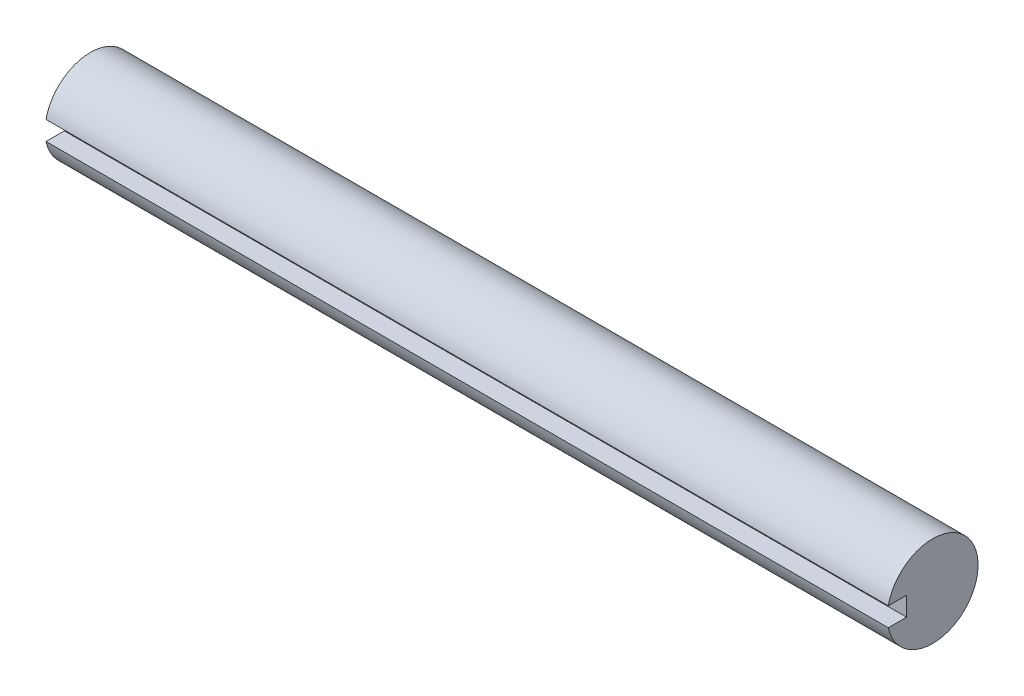
from build123d import *

# Parameters (mm, degrees)
BOSS_EXTRUDE2_DEPTH = 230


with BuildPart() as part:
    # Sketch1 → Boss-Extrude2 (new body)
    with BuildSketch(Plane.YZ):
        with BuildLine():
            Line((2.6, 7.124355653), (-2.6, 7.124355653))
            Line((-2.6, 7.124355653), (-2.6, 12.124355653))
            ThreePointArc((-2.6, 12.124355653), (-7.794870108, -9.643650761), (12.4, 0))
            ThreePointArc((12.4, 0), (9.643650761, 7.794870108), (2.6, 12.124355653))
            Line((2.6, 12.124355653), (2.6, 7.124355653))
        make_face()
    extrude(amount=BOSS_EXTRUDE2_DEPTH)


solid = part.part
